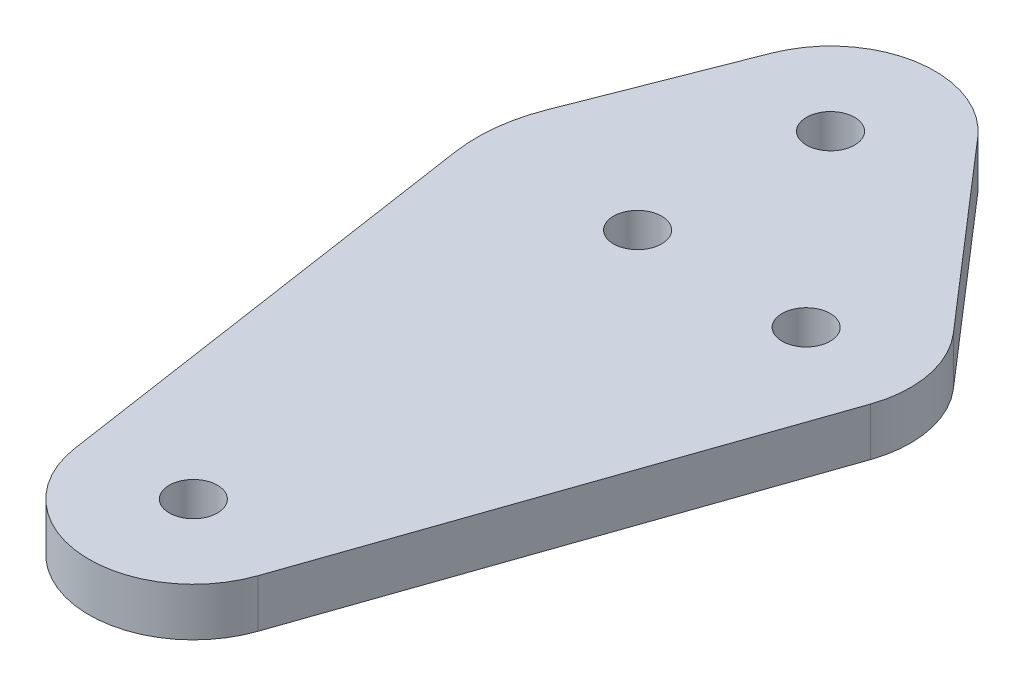
from build123d import *

# Parameters (mm, degrees)
SKETCH_1_R      = 1.5
EXTRUDE_1_DEPTH = 3


with BuildPart() as part:
    # ｽｹｯﾁ1 → ﾎﾞｽ - 押し出し1 (new body)
    with BuildSketch(Plane(origin=(0, 0, 0), x_dir=(1, 0, 0), z_dir=(0, 1, 0))):
        with BuildLine():
            Line((-4.906266911, 15.59418305), (4.913538149, 4.25524886))
            ThreePointArc((4.913538149, 4.25524886), (6.382873289, 1.228384537), (6.141922686, -2.12762443))
            Line((6.141922686, -2.12762443), (-3.677882374, -30.474959905))
            ThreePointArc((-3.677882374, -30.474959905), (-10.422574216, -34.819326618), (-16.248996967, -29.304148642))
            Line((-16.248996967, -29.304148642), (-20.391064471, -1.472020255))
            ThreePointArc((-20.391064471, -1.472020255), (-20.436566317, 1.124566508), (-19.811913018, 3.645308758))
            Line((-19.811913018, 3.645308758), (-15.872548522, 13.708384883))
            ThreePointArc((-15.872548522, 13.708384883), (-10.921397484, 17.744907507), (-4.906266911, 15.59418305))
        make_face()
        with Locations(Location((0, 0, 0), (0, 0, 270))):
            Circle(SKETCH_1_R, mode=Mode.SUBTRACT)
        with Locations(Location((-9.819805061, 11.33893419, 0), (0, 0, 270))):
            Circle(SKETCH_1_R, mode=Mode.SUBTRACT)
        with Locations(Location((-9.819805061, -28.347335476, 0), (0, 0, 270))):
            Circle(SKETCH_1_R, mode=Mode.SUBTRACT)
        with Locations(Location((-10.5, 0, 0), (0, 0, 270))):
            Circle(SKETCH_1_R, mode=Mode.SUBTRACT)
    extrude(amount=EXTRUDE_1_DEPTH)


solid = part.part
